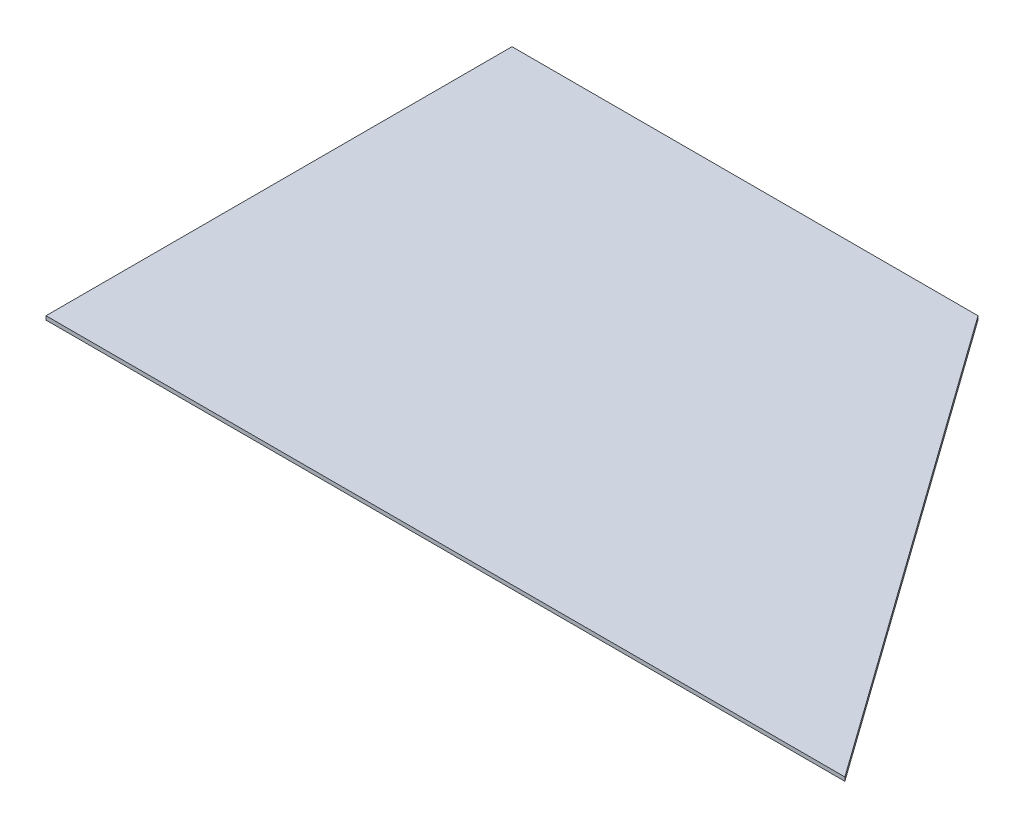
from build123d import *

# Parameters (mm, degrees)
BOSS_EXTRUDE1_DEPTH = 1


with BuildPart() as part:
    # Sketch1 → Boss-Extrude1 (new body)
    with BuildSketch(Plane(origin=(0, 0, 0), x_dir=(1, 0, 0), z_dir=(0, 1, 0))):
        Polygon((-17.5, 122.5), (17.5, 122.5), (105, 0), (-105, 0), (-105, 122.5), align=None)
    extrude(amount=BOSS_EXTRUDE1_DEPTH)


solid = part.part
